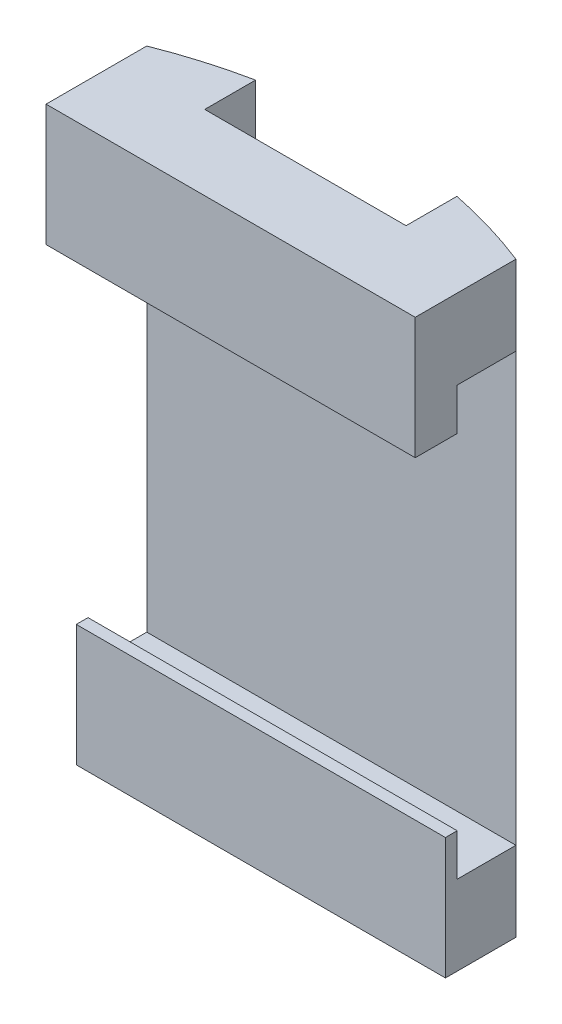
from build123d import *

# Parameters (mm, degrees)
BOSS_EXTRUDE1_DEPTH = 35
SKETCH2_W           = 22
SKETCH2_H           = 4.75
BOSS_EXTRUDE2_DEPTH = 6
SKETCH3_W           = 2.5
SKETCH3_H           = 2.5
BOSS_EXTRUDE3_DEPTH = 22
SKETCH4_W           = 22
SKETCH4_H           = 7.25
CUT_EXTRUDE1_DEPTH  = 1.8
SKETCH5_W           = 12
SKETCH5_H           = 5.357838174
CUT_EXTRUDE2_DEPTH  = 9.8


with BuildPart() as part:
    # Sketch1 → Boss-Extrude1 (new body)
    with BuildSketch(Plane(origin=(0, 0, 0), x_dir=(1, 0, 0), z_dir=(0, 1, 0))):
        with BuildLine():
            Line((-11, 27.910571474), (11, 27.910571474))
            ThreePointArc((11, 27.910571474), (0, 30), (-11, 27.910571474))
        make_face()
    extrude(amount=BOSS_EXTRUDE1_DEPTH)

    # Sketch2 → Boss-Extrude2 (add)
    with BuildSketch(Plane.XY.offset(-27.910571474)):
        with Locations((0, 32.625)):
            Rectangle(SKETCH2_W, SKETCH2_H)
        with Locations((0, 2.375)):
            Rectangle(SKETCH2_W, SKETCH2_H)
    extrude(amount=BOSS_EXTRUDE2_DEPTH)

    # Sketch3 → Boss-Extrude3 (add, through all)
    with BuildSketch(Plane.ZY.offset(11)):
        with Locations((-23.160571474, 29)):
            Rectangle(SKETCH3_W, SKETCH3_H)
        with Locations((-23.160571474, 6)):
            Rectangle(SKETCH3_W, SKETCH3_H)
    extrude(amount=-BOSS_EXTRUDE3_DEPTH)

    # Sketch4 → Cut-Extrude1 (cut)
    with BuildSketch(Plane.XY.offset(-21.910571474)):
        with Locations((0, 3.625)):
            Rectangle(SKETCH4_W, SKETCH4_H)
    extrude(amount=-CUT_EXTRUDE1_DEPTH, mode=Mode.SUBTRACT)

    # Sketch5 → Cut-Extrude2 (cut)
    with BuildSketch(Plane(origin=(0, 35, 0), x_dir=(1, 0, 0), z_dir=(0, 1, 0))):
        with Locations((0, 29.043466622)):
            Rectangle(SKETCH5_W, SKETCH5_H)
    extrude(amount=-CUT_EXTRUDE2_DEPTH, mode=Mode.SUBTRACT)


solid = part.part
